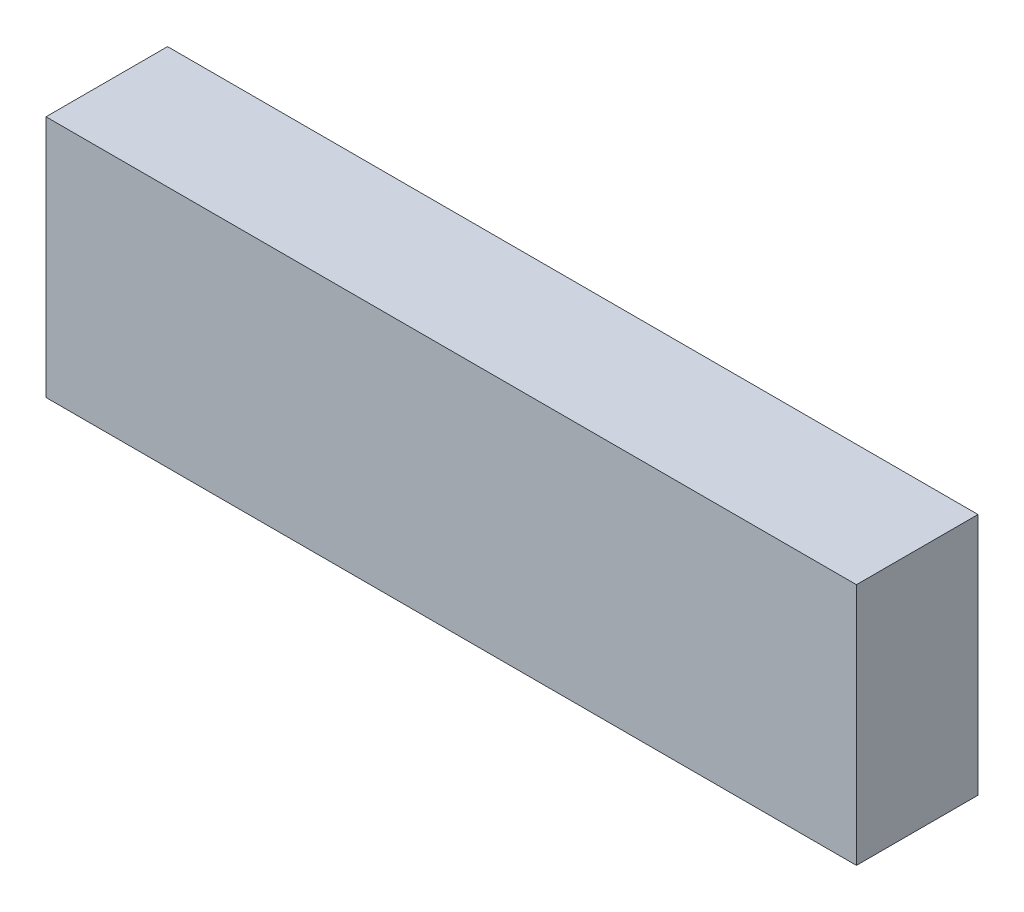
from build123d import *

# Parameters (mm, degrees)
SKETCH1_W           = 1000
SKETCH1_H           = 300
BOSS_EXTRUDE1_DEPTH = 150


with BuildPart() as part:
    # Sketch1 → Boss-Extrude1 (new body)
    with BuildSketch(Plane.XY):
        with Locations((500, 150)):
            Rectangle(SKETCH1_W, SKETCH1_H)
    extrude(amount=BOSS_EXTRUDE1_DEPTH)


solid = part.part
